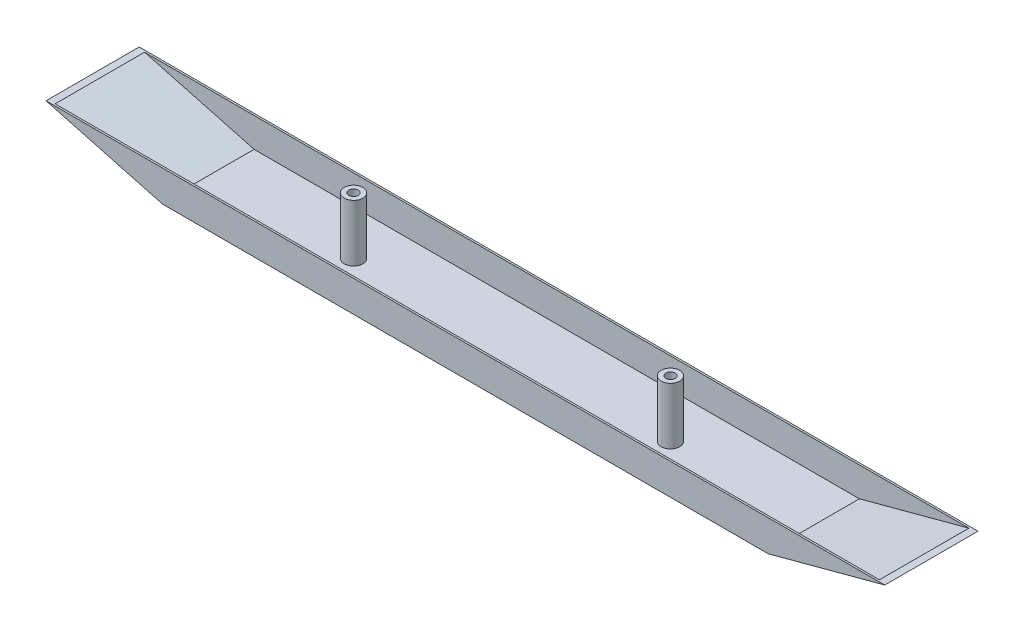
from build123d import *

# Parameters (mm, degrees)
BOSS_EXTRUDE1_DEPTH = 50
SHELL1_T            = -1
SKETCH2_R           = 2.5
CUT_EXTRUDE1_DEPTH  = 50
SKETCH3_R           = 5
SKETCH3_R_2         = 2.5
BOSS_EXTRUDE2_DEPTH = 30.5


with BuildPart() as part:
    # Sketch1 → Boss-Extrude1 (new body)
    with BuildSketch(Plane.XY):
        Polygon((-162.5, 0), (162.5, 0), (225, 16.746824527), (-225, 16.746824527), align=None)
    extrude(amount=BOSS_EXTRUDE1_DEPTH)

    # Shell1
    shell1_openings = [part.faces().sort_by_distance(p)[0] for p in [
        (0, 16.746824527, 25),
    ]]
    offset(amount=SHELL1_T, openings=shell1_openings, kind=Kind.INTERSECTION)

    # Sketch2 → Cut-Extrude1 (cut)
    with BuildSketch(Plane.XZ):
        with Locations(Location((-85, 25, 0), (0, 0, 270))):
            Circle(SKETCH2_R)
        with Locations(Location((85, 25, 0), (0, 0, 270))):
            Circle(SKETCH2_R)
    extrude(amount=-CUT_EXTRUDE1_DEPTH, mode=Mode.SUBTRACT)

    # Sketch3 → Boss-Extrude2 (add)
    # profile 1 of 2: a face of its own
    with BuildSketch(Plane(origin=(0, 1, 0), x_dir=(1, 0, 0), z_dir=(0, 1, 0))):
        with Locations(Location((-85, -25, 0), (0, 0, 90))):
            Circle(SKETCH3_R)
        with Locations(Location((-85, -25, 0), (0, 0, 90))):
            Circle(SKETCH3_R_2, mode=Mode.SUBTRACT)
    # profile 2 of 2: a face of its own
    with BuildSketch(Plane(origin=(0, 1, 0), x_dir=(1, 0, 0), z_dir=(0, 1, 0))):
        with Locations(Location((85, -25, 0), (0, 0, 90))):
            Circle(SKETCH3_R)
        with Locations(Location((85, -25, 0), (0, 0, 90))):
            Circle(SKETCH3_R_2, mode=Mode.SUBTRACT)
    extrude(amount=BOSS_EXTRUDE2_DEPTH)


solid = part.part
